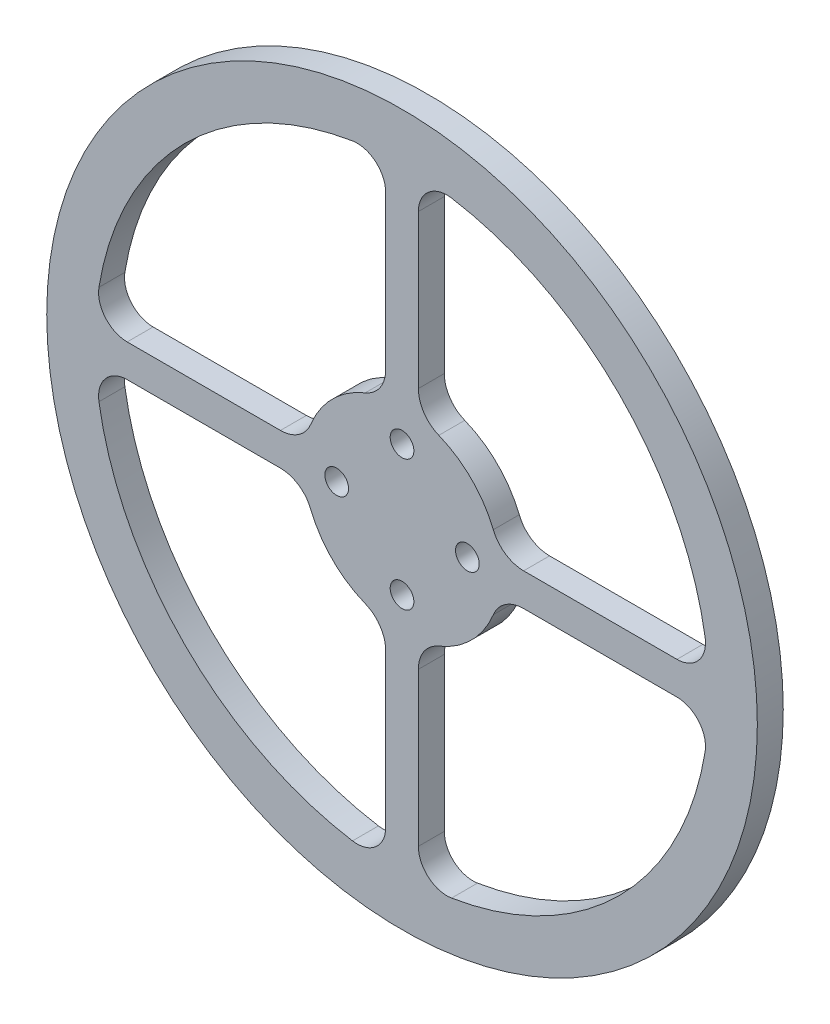
from build123d import *

# Parameters (mm, degrees)
SKETCH1_R           = 43.5
SKETCH1_R_2         = 1.45
BOSS_EXTRUDE1_DEPTH = 3.175
FILLET1_R           = 4
FILLET2_R           = 3.5
SKETCH3_R           = 3.225
BOSS_EXTRUDE2_DEPTH = 3.175


with BuildPart() as part:
    # Sketch1 → Boss-Extrude1 (new body)
    with BuildSketch(Plane.XY):
        Circle(SKETCH1_R)
        with Locations((0, 8)):
            Circle(SKETCH1_R_2, mode=Mode.SUBTRACT)
        with Locations((0, -8)):
            Circle(SKETCH1_R_2, mode=Mode.SUBTRACT)
        with Locations((8, 0)):
            Circle(SKETCH1_R_2, mode=Mode.SUBTRACT)
        with Locations((-8, 0)):
            Circle(SKETCH1_R_2, mode=Mode.SUBTRACT)
        with BuildLine():
            Line((-37.546770833, -2), (-11.882865816, -2))
            ThreePointArc((-11.882865816, -2), (-8.520636713, -8.520636713), (-2, -11.882865816))
            Line((-2, -11.882865816), (-2, -37.546770833))
            ThreePointArc((-2, -37.546770833), (-26.587214973, -26.587214973), (-37.546770833, -2))
        make_face(mode=Mode.SUBTRACT)
        with BuildLine():
            Line((-2, 37.546770833), (-2, 11.882865816))
            ThreePointArc((-2, 11.882865816), (-8.520636713, 8.520636713), (-11.882865816, 2))
            Line((-11.882865816, 2), (-37.546770833, 2))
            ThreePointArc((-37.546770833, 2), (-26.587214973, 26.587214973), (-2, 37.546770833))
        make_face(mode=Mode.SUBTRACT)
        with BuildLine():
            Line((2, 37.546770833), (2, 11.882865816))
            ThreePointArc((2, 11.882865816), (8.520636713, 8.520636713), (11.882865816, 2))
            Line((11.882865816, 2), (37.546770833, 2))
            ThreePointArc((37.546770833, 2), (26.587214973, 26.587214973), (2, 37.546770833))
        make_face(mode=Mode.SUBTRACT)
        with BuildLine():
            Line((11.882865816, -2), (37.546770833, -2))
            ThreePointArc((37.546770833, -2), (26.587214973, -26.587214973), (2, -37.546770833))
            Line((2, -37.546770833), (2, -11.882865816))
            ThreePointArc((2, -11.882865816), (8.520636713, -8.520636713), (11.882865816, -2))
        make_face(mode=Mode.SUBTRACT)
    extrude(amount=BOSS_EXTRUDE1_DEPTH)

    # Fillet1
    fillet1_edges = [part.edges().sort_by_distance(p)[0] for p in [
        (-11.882865816, 2, 1.5875),
        (-2, 11.882865816, 1.5875),
        (-2, -11.882865816, 1.5875),
        (-11.882865816, -2, 1.5875),
        (11.882865816, -2, 1.5875),
        (2, -11.882865816, 1.5875),
        (2, 11.882865816, 1.5875),
        (11.882865816, 2, 1.5875),
    ]]
    fillet(fillet1_edges, radius=FILLET1_R)

    # Fillet2
    fillet2_edges = [part.edges().sort_by_distance(p)[0] for p in [
        (-2, 37.546770833, 1.5875),
        (-37.546770833, 2, 1.5875),
        (-37.546770833, -2, 1.5875),
        (-2, -37.546770833, 1.5875),
        (2, -37.546770833, 1.5875),
        (37.546770833, -2, 1.5875),
        (37.546770833, 2, 1.5875),
        (2, 37.546770833, 1.5875),
    ]]
    fillet(fillet2_edges, radius=FILLET2_R)

    # Sketch3 → Boss-Extrude2 (add)
    with BuildSketch(Plane(origin=(0, 0, 0), x_dir=(-1, 0, 0), z_dir=(0, 0, -1))):
        with Locations(Location((0, 0, 0), (0, 0, 180))):
            Circle(SKETCH3_R)
    extrude(amount=BOSS_EXTRUDE2_DEPTH)


solid = part.part
